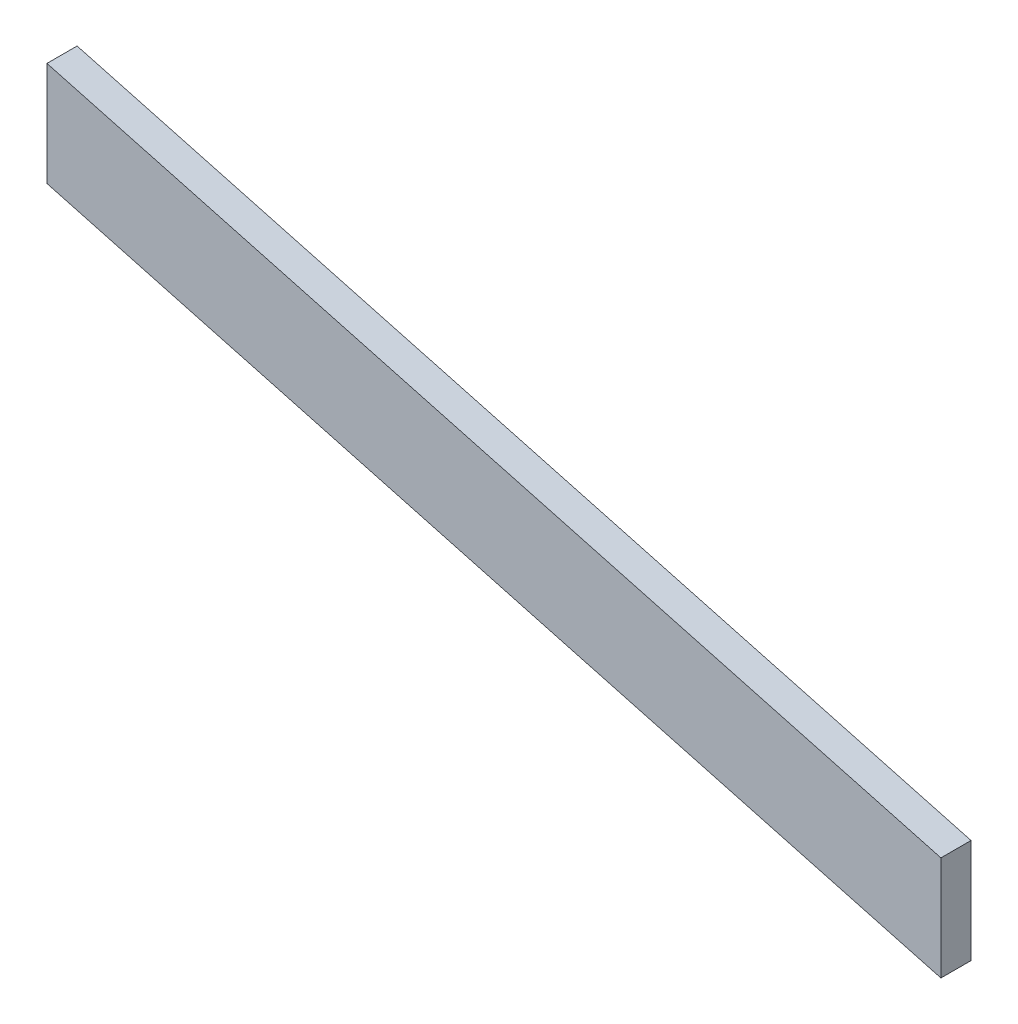
from build123d import *

# Parameters (mm, degrees)
BOSS_EXTRUDE1_DEPTH = 19.05


with BuildPart() as part:
    # Sketch2 → Boss-Extrude1 (new body)
    with BuildSketch(Plane.XY):
        Polygon((-768.93449825, 901.198014599), (-768.93449825, 966.966301204), (-203.78449825, 814.566301204), (-203.78449825, 748.798014599), align=None)
    extrude(amount=BOSS_EXTRUDE1_DEPTH)


solid = part.part
